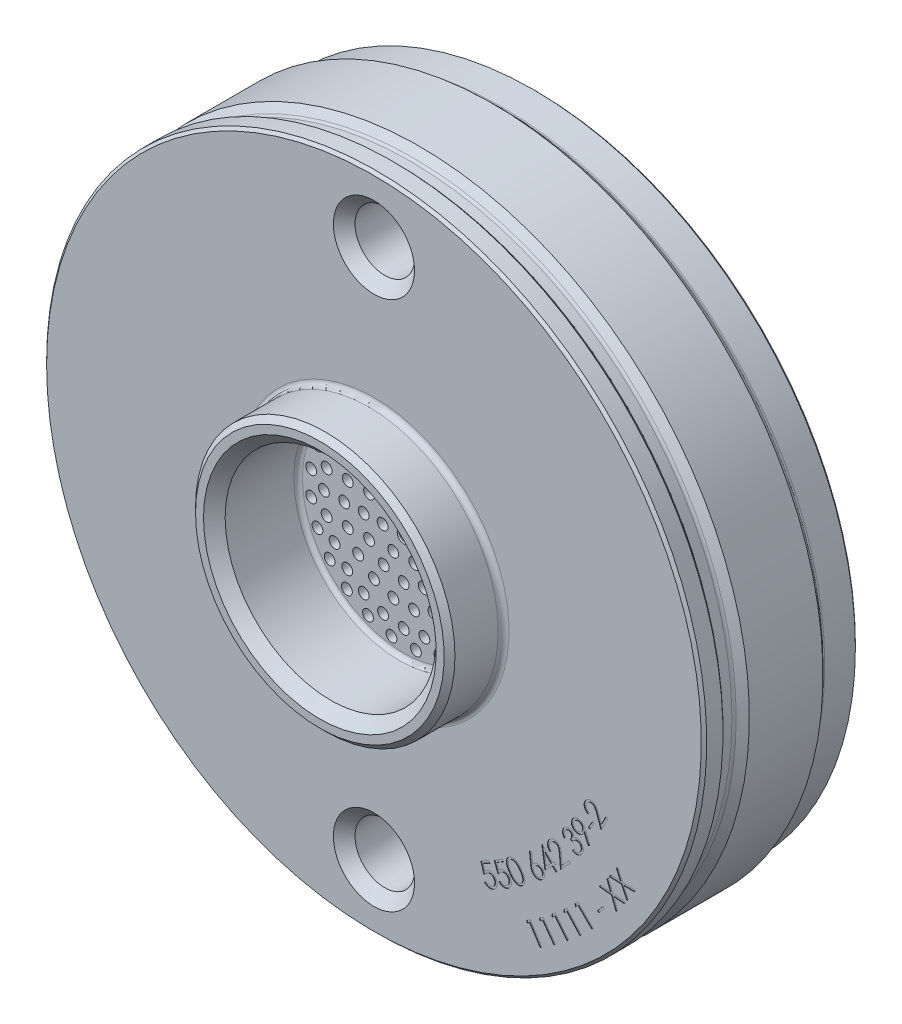
from build123d import *

# Parameters (mm, degrees)
F_11_0_11_DIAMETER_HOLE1_D           = 11
F_11_0_11_DIAMETER_HOLE1_DEPTH       = 12
F_11_0_11_DIAMETER_HOLE1_CSINK_D     = 15
F_11_0_11_DIAMETER_HOLE1_CSINK_ANGLE = 90
F_11_0_11_DIAMETER_HOLE1_TIP         = 3.304733405
CUT_EXTRUDE1_DEPTH                   = 0.1
F_2_0_2_DIAMETER_HOLE1_D             = 2
FILLET1_R                            = 0.8
CHAMFER1_SIZE                        = 0.2


with BuildPart() as part:
    # Sketch1 → Revolve1 (revolve)
    with BuildSketch(Plane(origin=(0, 0, 0), x_dir=(0, 0, -1), z_dir=(1, 0, 0)), mode=Mode.PRIVATE) as revolve1_sk:
        with BuildLine():
            Line((0, 48.5), (0, 59))
            Line((0, 59), (-0.5, 59.5))
            Line((-0.5, 59.5), (-6.16862915, 59.5))
            ThreePointArc((-6.16862915, 59.5), (-6.474775896, 59.560896374), (-6.734314575, 59.734314575))
            Line((-6.734314575, 59.734314575), (-7.95, 60.95))
            Line((-7.95, 60.95), (-21.55, 60.95))
            Line((-21.55, 60.95), (-22.765685425, 59.734314575))
            ThreePointArc((-22.765685425, 59.734314575), (-23.025224104, 59.560896374), (-23.33137085, 59.5))
            Line((-23.33137085, 59.5), (-25.18, 59.5))
            ThreePointArc((-25.18, 59.5), (-25.745685425, 59.734314575), (-25.98, 60.3))
            Line((-25.98, 60.3), (-25.98, 60.5))
            Line((-25.98, 60.5), (-26.48, 61))
            Line((-26.48, 61), (-29.48, 61))
            Line((-29.48, 61), (-29.98, 60.5))
            Line((-29.98, 60.5), (-29.98, 24.975))
            ThreePointArc((-29.98, 24.975), (-30.272893219, 24.267893219), (-30.98, 23.975))
            Line((-30.98, 23.975), (-38.98, 23.975))
            Line((-38.98, 23.975), (-39.98, 22.975))
            Line((-39.98, 22.975), (-39.98, 21.5))
            Line((-39.98, 21.5), (-37.98, 19.5))
            Line((-37.98, 19.5), (-24.48, 19.5))
            Line((-24.48, 19.5), (-24.48, 0))
            Line((-24.48, 0), (-18.95, 0))
            Line((-18.95, 0), (-18.95, 24.243093767))
            ThreePointArc((-18.95, 24.243093767), (-14.286781708, 37.786948462), (-2.274, 45.589171252))
            ThreePointArc((-2.274, 45.589171252), (-0.635893403, 46.653110723), (0, 48.5))
        make_face()
    revolve(revolve1_sk.sketch.rotate(Axis((0, 0, 0), (0, 0, 1)), 90), axis=Axis((0, 0, 0), (0, 0, 1)))

    # Ø11.0 (11) Diameter Hole1
    with Locations(Plane.XY.offset(29.98)):
        with Locations((0, -49), (0, 49)):
            CounterSinkHole(F_11_0_11_DIAMETER_HOLE1_D / 2, F_11_0_11_DIAMETER_HOLE1_CSINK_D / 2, depth=F_11_0_11_DIAMETER_HOLE1_DEPTH, counter_sink_angle=F_11_0_11_DIAMETER_HOLE1_CSINK_ANGLE)
            with Locations((0, 0, -(F_11_0_11_DIAMETER_HOLE1_DEPTH + F_11_0_11_DIAMETER_HOLE1_TIP / 2))):  # 118° drill point
                Cone(0, F_11_0_11_DIAMETER_HOLE1_D / 2, F_11_0_11_DIAMETER_HOLE1_TIP, mode=Mode.SUBTRACT)

    # Sketch18 → Cut-Extrude1 (cut)
    # profile 1 of 18: a face of its own
    with BuildSketch(Plane.XY.offset(29.98)):
        with BuildLine():
            Line((21.27644483, -38.521881996), (21.451124318, -38.858420458))
            Line((21.451124318, -38.858420458), (20.191508933, -39.51146533))
            Line((20.191508933, -39.51146533), (20.515226882, -40.566753791))
            add(Edge.make_bspline(
                [(20.515226882, -40.566753791), (20.547408769, -40.536904813), (20.60957525, -40.479244868), (20.706337394, -40.403190183), (20.800611648, -40.337256226), (20.865342477, -40.301289595), (20.896637138, -40.283901227)],
                knots=[0, 0, 0, 0, 1.105428389, 2.135381016, 3.098534353, 4, 4, 4, 4], degree=3))
            add(Edge.make_bspline(
                [(20.896637138, -40.283901227), (20.936640487, -40.264462137), (21.014961783, -40.226402955), (21.136279584, -40.182776443), (21.257414168, -40.152650923), (21.378572955, -40.132936329), (21.49985412, -40.129879758), (21.620951617, -40.137500513), (21.741774496, -40.158711559), (21.861466791, -40.192297775), (21.977734288, -40.237589196), (22.088207122, -40.294155458), (22.192274331, -40.360669408), (22.28891701, -40.439227237), (22.378793214, -40.52837429), (22.461458092, -40.628343041), (22.537537332, -40.7387575), (22.58109865, -40.818470932), (22.603367907, -40.85922174)],
                knots=[0, 0, 0, 0, 1.056811306, 2.069097534, 3.057789082, 4.02136795, 4.980690457, 5.935252029, 6.90190139, 7.890980264, 8.886175095, 9.86305164, 10.837055529, 11.816816882, 12.818070179, 13.841624952, 14.896603437, 16, 16, 16, 16], degree=3))
            add(Edge.make_bspline(
                [(22.603367907, -40.85922174), (22.63111572, -40.917348636), (22.685723876, -41.031743329), (22.739792203, -41.212923179), (22.772053908, -41.396614405), (22.7768758, -41.551642269), (22.769394881, -41.674646424), (22.758356095, -41.764879369), (22.741411054, -41.852667618), (22.719006455, -41.938180911), (22.690240884, -42.021184871), (22.655314996, -42.101861802), (22.615611645, -42.180278894), (22.569507701, -42.255868035), (22.518550129, -42.328545812), (22.462015018, -42.397855478), (22.400464253, -42.463787461), (22.332427028, -42.525211429), (22.260768424, -42.584777342), (22.183180819, -42.640105106), (22.10098306, -42.692392583), (22.04295035, -42.723373601), (22.013624318, -42.739029432)],
                knots=[0, 0, 0, 0, 1.748045973, 3.440183427, 5.119068867, 6.803952498, 7.640180652, 8.466618387, 9.272301908, 10.068050927, 10.866839438, 11.656907904, 12.45543257, 13.253330256, 14.060809883, 14.86564294, 15.682076094, 16.509151021, 17.354838291, 18.212924379, 19.096925907, 20, 20, 20, 20], degree=3))
            add(Edge.make_bspline(
                [(22.013624318, -42.739029432), (21.978123313, -42.756514679), (21.908106496, -42.790999937), (21.799772028, -42.83056192), (21.691614353, -42.860849113), (21.583452352, -42.880100596), (21.475081608, -42.8887513), (21.366653578, -42.888476495), (21.258007473, -42.875981537), (21.150209911, -42.85363974), (21.045224493, -42.821641836), (20.943838283, -42.781535865), (20.848033186, -42.731699086), (20.756715826, -42.673710571), (20.670714703, -42.606793402), (20.589571816, -42.531343866), (20.513778481, -42.446544048), (20.468016017, -42.38496727), (20.444714061, -42.353612766)],
                knots=[0, 0, 0, 0, 1.070326981, 2.110951231, 3.115813232, 4.106958124, 5.078831873, 6.054702745, 7.036552097, 8.033164546, 9.030170131, 10.003333336, 10.979685974, 11.948220681, 12.927085357, 13.924431534, 14.943133697, 16, 16, 16, 16], degree=3))
            Line((20.444714061, -42.353612766), (20.80769483, -42.165311483))
            add(Edge.make_bspline(
                [(20.80769483, -42.165311483), (20.832013106, -42.194098476), (20.878898976, -42.249600075), (20.955287693, -42.32236969), (21.033997519, -42.381535904), (21.115780351, -42.427295471), (21.200818344, -42.461566534), (21.290982485, -42.483668318), (21.385522111, -42.496509607), (21.483888555, -42.498896834), (21.583043687, -42.490086467), (21.680499284, -42.470667931), (21.775298934, -42.441533945), (21.834721995, -42.412883319), (21.864585856, -42.39848456)],
                knots=[0, 0, 0, 0, 1.148091184, 2.213530881, 3.208448489, 4.141584939, 5.062314057, 5.99434879, 6.963857466, 7.965580902, 8.98722283, 9.991556689, 10.990629709, 12, 12, 12, 12], degree=3))
            add(Edge.make_bspline(
                [(21.864585856, -42.39848456), (21.892719147, -42.382759841), (21.948249393, -42.351721968), (22.024543891, -42.295769967), (22.09397455, -42.234183673), (22.155356544, -42.165029548), (22.209987659, -42.089847384), (22.256713706, -42.007588461), (22.295007412, -41.918399403), (22.326946733, -41.824201904), (22.349910655, -41.726267562), (22.364019507, -41.627301002), (22.36685406, -41.527950087), (22.36083474, -41.428576698), (22.343371265, -41.329122801), (22.316950467, -41.229901774), (22.280801812, -41.130223655), (22.249283229, -41.065948089), (22.2331756, -41.033099945)],
                knots=[0, 0, 0, 0, 0.981645936, 1.9375991, 2.877432958, 3.805770378, 4.750353123, 5.705682002, 6.682827047, 7.704964642, 8.733856986, 9.744811227, 10.746775224, 11.758450475, 12.774375794, 13.819092033, 14.885443033, 16, 16, 16, 16], degree=3))
            add(Edge.make_bspline(
                [(22.2331756, -41.033099945), (22.217396411, -41.004212502), (22.186514055, -40.947675228), (22.132400344, -40.86971477), (22.073575345, -40.79926025), (22.009749701, -40.736870155), (21.94067969, -40.682397384), (21.867022522, -40.636075041), (21.788507786, -40.597014786), (21.705656652, -40.566951627), (21.619733013, -40.545304243), (21.532235059, -40.532258043), (21.443551316, -40.529083011), (21.353863725, -40.535698368), (21.263092102, -40.551758506), (21.171394523, -40.578151825), (21.078024861, -40.612121336), (21.017373814, -40.642020164), (20.986380728, -40.657298663)],
                knots=[0, 0, 0, 0, 1.076667265, 2.107207309, 3.099980189, 4.076690109, 5.022799446, 5.973501378, 6.91957033, 7.88747805, 8.852143453, 9.815183605, 10.777390248, 11.750219731, 12.753367975, 13.788421301, 14.869868663, 16, 16, 16, 16], degree=3))
            add(Edge.make_bspline(
                [(20.986380728, -40.657298663), (20.959997215, -40.671907963), (20.90560683, -40.702025464), (20.82608036, -40.755141791), (20.745172731, -40.815714607), (20.663757215, -40.884954796), (20.580417233, -40.961739599), (20.496387742, -41.046932393), (20.41129546, -41.139875664), (20.356049448, -41.205954542), (20.327726882, -41.239830714)],
                knots=[0, 0, 0, 0, 0.817702769, 1.685718268, 2.591285642, 3.557827698, 4.583179527, 5.664073486, 6.802457763, 8, 8, 8, 8], degree=3))
            Line((20.327726882, -41.239830714), (19.74519483, -39.315952509))
            Line((19.74519483, -39.315952509), (21.27644483, -38.521881996))
        make_face()
    # profile 2 of 18: a face of its own
    with BuildSketch(Plane.XY.offset(29.98)):
        with BuildLine():
            Line((23.70916149, -37.06250728), (23.905475593, -37.388629075))
            Line((23.905475593, -37.388629075), (22.685123029, -38.121802152))
            Line((22.685123029, -38.121802152), (23.07614867, -39.157859845))
            add(Edge.make_bspline(
                [(23.07614867, -39.157859845), (23.106515441, -39.126254802), (23.165183953, -39.065193953), (23.256159744, -38.982202366), (23.346132797, -38.910089091), (23.408852427, -38.870216667), (23.439129439, -38.850968819)],
                knots=[0, 0, 0, 0, 1.102829987, 2.130664318, 3.097604677, 4, 4, 4, 4], degree=3))
            add(Edge.make_bspline(
                [(23.439129439, -38.850968819), (23.478025642, -38.828904072), (23.554183934, -38.785701564), (23.672880484, -38.733742843), (23.792657539, -38.696561849), (23.91291503, -38.669762058), (24.034203362, -38.658519122), (24.156121146, -38.657824948), (24.278552568, -38.672074832), (24.400655045, -38.698393384), (24.519971072, -38.736749868), (24.634776731, -38.785449323), (24.742595107, -38.846843763), (24.843799408, -38.919695243), (24.94010214, -39.00232645), (25.028539674, -39.097609207), (25.112313806, -39.202886477), (25.160497814, -39.280204298), (25.185123029, -39.319718819)],
                knots=[0, 0, 0, 0, 1.058528882, 2.072586693, 3.060770653, 4.024670191, 4.984431329, 5.939491772, 6.906871252, 7.896834851, 8.892961989, 9.870461465, 10.84482513, 11.824184935, 12.819629119, 13.844283023, 14.898286032, 16, 16, 16, 16], degree=3))
            add(Edge.make_bspline(
                [(25.185123029, -39.319718819), (25.201540135, -39.347819767), (25.233992001, -39.403367206), (25.275501773, -39.489805664), (25.311979176, -39.57707183), (25.341330794, -39.666160987), (25.365442544, -39.756039226), (25.384250151, -39.846938183), (25.39600687, -39.939373806), (25.402310783, -40.03247947), (25.403484057, -40.125097505), (25.397533056, -40.216075668), (25.386656533, -40.305305985), (25.368820034, -40.392521425), (25.345611902, -40.477670441), (25.316634965, -40.560753654), (25.281507368, -40.641770281), (25.239399674, -40.720009327), (25.193239254, -40.796437835), (25.140889754, -40.869462297), (25.08309107, -40.939378805), (25.019583418, -41.005696152), (24.951358162, -41.069445588), (24.877072826, -41.1293625), (24.798238265, -41.187545698), (24.741751576, -41.222103502), (24.713167901, -41.239590614)],
                knots=[0, 0, 0, 0, 1.05692593, 2.089236547, 3.112499505, 4.127784259, 5.133905672, 6.134549002, 7.140894905, 8.158513096, 9.165120839, 10.147538755, 11.118353283, 12.08325527, 13.036854021, 13.983637869, 14.939602483, 15.902277905, 16.868115858, 17.838503713, 18.818427546, 19.812729982, 20.819674277, 21.84964819, 22.911868288, 24, 24, 24, 24], degree=3))
            add(Edge.make_bspline(
                [(24.713167901, -41.239590614), (24.678820016, -41.259555516), (24.611147338, -41.298890645), (24.504725178, -41.344374783), (24.398841206, -41.38241173), (24.291494475, -41.407613633), (24.183801877, -41.424017138), (24.075064086, -41.429918991), (23.965670436, -41.423618212), (23.856142874, -41.408895038), (23.748706668, -41.383102195), (23.644852704, -41.348730227), (23.545715991, -41.305047768), (23.450571129, -41.252835127), (23.359987437, -41.190971413), (23.274033652, -41.119803819), (23.191738133, -41.040691475), (23.142143293, -40.981780164), (23.117014055, -40.951930357)],
                knots=[0, 0, 0, 0, 1.070212441, 2.108547409, 3.115231964, 4.100383038, 5.076091677, 6.049618532, 7.030337432, 8.026404567, 9.025564965, 10.004828497, 10.972236263, 11.942427787, 12.927183942, 13.924889881, 14.948561242, 16, 16, 16, 16], degree=3))
            Line((23.117014055, -40.951930357), (23.468776875, -40.740391896))
            add(Edge.make_bspline(
                [(23.468776875, -40.740391896), (23.494556256, -40.76807422), (23.544305799, -40.821496098), (23.627018421, -40.8873927), (23.70898938, -40.942892079), (23.794318174, -40.983082597), (23.882088221, -41.011794318), (23.973764058, -41.028092535), (24.069105872, -41.035734698), (24.16742284, -41.031121406), (24.266172362, -41.017321019), (24.362336364, -40.991429687), (24.454978014, -40.955360344), (24.512648683, -40.923236962), (24.541693542, -40.907058562)],
                knots=[0, 0, 0, 0, 1.147819284, 2.215083569, 3.20552295, 4.149378301, 5.070774502, 6.003573808, 6.972124367, 7.971204786, 8.988124418, 9.996065887, 10.990752398, 12, 12, 12, 12], degree=3))
            add(Edge.make_bspline(
                [(24.541693542, -40.907058562), (24.569077311, -40.889741626), (24.6231041, -40.855576187), (24.696270854, -40.794811345), (24.761443144, -40.728128532), (24.818820561, -40.655271642), (24.868801158, -40.576487631), (24.910572108, -40.490996881), (24.944089378, -40.399366613), (24.969558992, -40.302800288), (24.986298831, -40.203564221), (24.993584261, -40.103494138), (24.991387634, -40.003884363), (24.978481056, -39.904766342), (24.95475501, -39.806419523), (24.921724219, -39.70859896), (24.879473485, -39.610887615), (24.843605127, -39.548560169), (24.825347388, -39.516834204)],
                knots=[0, 0, 0, 0, 0.983024875, 1.939458249, 2.880079426, 3.809832916, 4.750384155, 5.707986049, 6.69335027, 7.7084736, 8.73650763, 9.744869032, 10.750879176, 11.75688932, 12.773954853, 13.817831855, 14.889231074, 16, 16, 16, 16], degree=3))
            add(Edge.make_bspline(
                [(24.825347388, -39.516834204), (24.807646139, -39.48900546), (24.772988488, -39.434518971), (24.71407876, -39.359588281), (24.65093506, -39.292843361), (24.582759381, -39.234628532), (24.510863945, -39.183964181), (24.434115438, -39.141708544), (24.352544075, -39.109291624), (24.267970766, -39.083473314), (24.180743644, -39.066249752), (24.092263715, -39.060388833), (24.003378649, -39.06246582), (23.913971633, -39.074817084), (23.8239948, -39.09643245), (23.733976815, -39.128483544), (23.642572262, -39.168142063), (23.583847925, -39.202121549), (23.553712773, -39.219558562)],
                knots=[0, 0, 0, 0, 1.075733153, 2.106200774, 3.104921805, 4.069200433, 5.026719599, 5.970655112, 6.920727303, 7.885793418, 8.853296673, 9.814576963, 10.773681559, 11.749939262, 12.754084145, 13.787753641, 14.864757179, 16, 16, 16, 16], degree=3))
            add(Edge.make_bspline(
                [(23.553712773, -39.219558562), (23.528068246, -39.235727714), (23.475477117, -39.268886992), (23.399450988, -39.327770543), (23.321705081, -39.392736241), (23.24456154, -39.467591572), (23.166495644, -39.549642919), (23.087562523, -39.639940189), (23.008385449, -39.738475168), (22.956789907, -39.808054774), (22.930315337, -39.84375728)],
                knots=[0, 0, 0, 0, 0.819138095, 1.679867183, 2.597021237, 3.557141982, 4.583739267, 5.658351996, 6.798459653, 8, 8, 8, 8], degree=3))
            Line((22.930315337, -39.84375728), (22.225187132, -37.954334204))
            Line((22.225187132, -37.954334204), (23.70916149, -37.06250728))
        make_face()
    # profile 3 of 18: a face of its own
    with BuildSketch(Plane.XY.offset(29.98)):
        with BuildLine():
            add(Edge.make_bspline(
                [(25.067604612, -38.574110643), (25.031440738, -38.521204796), (24.961274924, -38.418555899), (24.865289902, -38.265118053), (24.779118256, -38.118775197), (24.704260608, -37.978147485), (24.640139809, -37.843650749), (24.585865244, -37.7155708), (24.543320249, -37.593452327), (24.510380391, -37.477115749), (24.488664247, -37.364888184), (24.471706886, -37.256463308), (24.464000908, -37.150638467), (24.462959115, -37.047837525), (24.469383251, -36.947937166), (24.482863289, -36.85093037), (24.503902875, -36.756659551), (24.531597988, -36.665384271), (24.567312799, -36.578128013), (24.607876447, -36.494624973), (24.654816898, -36.415797817), (24.706660453, -36.3408087), (24.765743842, -36.271132499), (24.829742067, -36.205247361), (24.899785087, -36.143982988), (24.950069346, -36.107136835), (24.975457176, -36.08853372)],
                knots=[0, 0, 0, 0, 1.648880835, 3.199188929, 4.656147039, 6.018196139, 7.297073251, 8.489259402, 9.595625968, 10.622797314, 11.597320629, 12.535289308, 13.445112111, 14.324870503, 15.178882248, 16.018671089, 16.842416504, 17.662022758, 18.469903163, 19.266003679, 20.04867009, 20.82849472, 21.609045895, 22.39640582, 23.190367395, 24, 24, 24, 24], degree=3))
            add(Edge.make_bspline(
                [(24.975457176, -36.08853372), (25.002209226, -36.071074774), (25.0551918, -36.03649724), (25.13805137, -35.991385794), (25.223051407, -35.953758097), (25.310073683, -35.923027152), (25.399327536, -35.899691009), (25.491038564, -35.883908608), (25.584722891, -35.874158669), (25.680393103, -35.87157122), (25.777063847, -35.877563144), (25.874976829, -35.890080499), (25.973214614, -35.912049828), (26.072068501, -35.941701738), (26.171148929, -35.980046754), (26.271394052, -36.02524741), (26.371304199, -36.080605547), (26.473046956, -36.142146876), (26.575264923, -36.213850943), (26.677802565, -36.296815017), (26.781225104, -36.390563476), (26.884518618, -36.496383912), (26.989325732, -36.612149811), (27.094529712, -36.739701612), (27.200917707, -36.877672437), (27.269626716, -36.975285353), (27.304784099, -37.025232438)],
                knots=[0, 0, 0, 0, 0.816193038, 1.616474579, 2.407974418, 3.189491804, 3.972617313, 4.762673534, 5.56551282, 6.378072658, 7.205407521, 8.03855107, 8.898147562, 9.774918361, 10.673732565, 11.611515667, 12.582857779, 13.59082979, 14.649420231, 15.770911779, 16.959705856, 18.214699789, 19.548597452, 20.949604708, 22.439157853, 24, 24, 24, 24], degree=3))
            add(Edge.make_bspline(
                [(27.304784099, -37.025232438), (27.339049821, -37.075754036), (27.405642174, -37.173938223), (27.49728326, -37.321222737), (27.579190868, -37.463473866), (27.650803639, -37.601721695), (27.712482009, -37.735064242), (27.76448583, -37.863767113), (27.805294853, -37.988075454), (27.836926904, -38.107959012), (27.859266056, -38.223961161), (27.874638813, -38.336301579), (27.883082701, -38.445488196), (27.882868953, -38.551797769), (27.875933348, -38.65491746), (27.861269114, -38.755051437), (27.840150656, -38.852001759), (27.810075762, -38.945020411), (27.773913098, -39.034069732), (27.732399923, -39.119103223), (27.684991162, -39.199485947), (27.631775504, -39.27539277), (27.572485352, -39.346623723), (27.50733167, -39.413267175), (27.436473172, -39.475636487), (27.385226467, -39.512813471), (27.359271278, -39.531642695)],
                knots=[0, 0, 0, 0, 1.562410196, 3.036403893, 4.438953896, 5.762941119, 7.020166583, 8.198282941, 9.313840987, 10.366808227, 11.369714488, 12.335610463, 13.267896066, 14.170325268, 15.054388479, 15.911010107, 16.758581212, 17.590989815, 18.409840322, 19.2170207, 20.010800903, 20.796026648, 21.587329968, 22.380196983, 23.179609817, 24, 24, 24, 24], degree=3))
            add(Edge.make_bspline(
                [(27.359271278, -39.531642695), (27.333158941, -39.549291651), (27.281482102, -39.584219289), (27.198751837, -39.626523247), (27.115761738, -39.665389507), (27.029481699, -39.69423095), (26.942206893, -39.718374806), (26.852412052, -39.732687044), (26.760987827, -39.743235295), (26.667418751, -39.744188121), (26.572791487, -39.739041998), (26.477814591, -39.724764991), (26.382154571, -39.704544087), (26.286674477, -39.673953931), (26.190318294, -39.637456813), (26.093862006, -39.592046964), (25.996984095, -39.539118881), (25.899090627, -39.477986565), (25.801014363, -39.405690889), (25.700322602, -39.323203407), (25.59925074, -39.227318292), (25.495277658, -39.120575658), (25.390982442, -39.000915397), (25.283967628, -38.869797926), (25.175355692, -38.726695154), (25.104161428, -38.625878142), (25.067604612, -38.574110643)],
                knots=[0, 0, 0, 0, 0.81152306, 1.606020402, 2.391670559, 3.171052736, 3.947510848, 4.722747345, 5.511858203, 6.317402894, 7.13114196, 7.951839656, 8.790359576, 9.64823863, 10.532932001, 11.444534705, 12.393352557, 13.376992827, 14.416566744, 15.531560906, 16.729652367, 18.005142895, 19.370917127, 20.819142754, 22.366694092, 24, 24, 24, 24], degree=3))
        make_face()
        with BuildLine():
            add(Edge.make_bspline(
                [(25.380905894, -38.36577731), (25.412125665, -38.410596896), (25.47256786, -38.497368644), (25.565140135, -38.619794314), (25.653863473, -38.732434135), (25.740400492, -38.834318964), (25.824146419, -38.925669017), (25.905294759, -39.006014177), (25.982948699, -39.076362187), (26.081639349, -39.154033382), (26.204006079, -39.23314069), (26.353105423, -39.304198683), (26.502784405, -39.34954462), (26.650893286, -39.368687379), (26.793862463, -39.364659847), (26.928386334, -39.340608867), (27.054418445, -39.297446205), (27.128449532, -39.251076484), (27.165361022, -39.227956797)],
                knots=[0, 0, 0, 0, 1.18360187, 2.291480407, 3.325641566, 4.290620188, 5.187729821, 6.010420189, 6.76463185, 7.457100541, 8.730339266, 9.913672188, 11.025279315, 12.105085573, 13.135806874, 14.112227409, 15.058767036, 16, 16, 16, 16], degree=3))
            add(Edge.make_bspline(
                [(27.165361022, -39.227956797), (27.200119041, -39.201378035), (27.269582952, -39.14826037), (27.354408456, -39.046463979), (27.424677444, -38.931090475), (27.467393197, -38.823535483), (27.494463812, -38.731741949), (27.507814602, -38.658956451), (27.514931347, -38.583622709), (27.516390169, -38.505962755), (27.512522429, -38.425594408), (27.501782819, -38.342616992), (27.485065639, -38.257252565), (27.469659859, -38.200095441), (27.461835381, -38.171065772)],
                knots=[0, 0, 0, 0, 1.336851993, 2.671699108, 4.03011382, 5.461489002, 6.202186282, 6.95968723, 7.724226666, 8.518110209, 9.337395127, 10.186892147, 11.079136272, 12, 12, 12, 12], degree=3))
            add(Edge.make_bspline(
                [(27.461835381, -38.171065772), (27.450970543, -38.134361257), (27.428905283, -38.05981853), (27.388586834, -37.948249989), (27.341034493, -37.835362398), (27.287187236, -37.720343329), (27.226295392, -37.603488921), (27.15805526, -37.484848234), (27.082478914, -37.36461294), (27.028566857, -37.284699183), (27.001098201, -37.243982438)],
                knots=[0, 0, 0, 0, 0.883199446, 1.793678394, 2.735757982, 3.709095344, 4.723597835, 5.775548499, 6.866622892, 8, 8, 8, 8], degree=3))
            add(Edge.make_bspline(
                [(27.001098201, -37.243982438), (26.973002189, -37.204032666), (26.917925053, -37.125718381), (26.833544719, -37.013508173), (26.747842486, -36.910605416), (26.665418542, -36.813337052), (26.580483341, -36.726834284), (26.498667593, -36.645784324), (26.415447528, -36.574447716), (26.333447309, -36.51037919), (26.251827857, -36.45414437), (26.172159466, -36.403905661), (26.092236295, -36.362378076), (26.014010474, -36.326909794), (25.936688353, -36.298422228), (25.860199937, -36.27779467), (25.785046355, -36.262651589), (25.687678854, -36.254903664), (25.570882917, -36.258086117), (25.437421287, -36.280865106), (25.313169747, -36.324715607), (25.239707136, -36.370271258), (25.203021278, -36.3930209)],
                knots=[0, 0, 0, 0, 1.324721128, 2.59687554, 3.806453397, 4.95685349, 6.053294923, 7.093309125, 8.079471706, 9.024294149, 9.914547597, 10.766943994, 11.577070158, 12.355310455, 13.095566322, 13.809107535, 14.502467157, 15.171479925, 16.45427501, 17.660811757, 18.831853037, 20, 20, 20, 20], degree=3))
            add(Edge.make_bspline(
                [(25.203021278, -36.3930209), (25.168297512, -36.419623915), (25.098602389, -36.473019633), (25.012803807, -36.575186392), (24.943172684, -36.692600584), (24.899311189, -36.801052966), (24.872289043, -36.894057162), (24.859161104, -36.967685804), (24.851076521, -37.043457287), (24.848508387, -37.121423943), (24.852916801, -37.201739155), (24.86253421, -37.284436374), (24.878031133, -37.369467464), (24.898660901, -37.457779977), (24.928244013, -37.550025202), (24.966153309, -37.647856606), (25.012944545, -37.752022228), (25.068306518, -37.862826773), (25.133575534, -37.979576543), (25.207453386, -38.102939743), (25.289911261, -38.23304961), (25.349906134, -38.320560062), (25.380905894, -38.36577731)],
                knots=[0, 0, 0, 0, 1.182397344, 2.373225514, 3.587098347, 4.869233932, 5.531312716, 6.208410436, 6.892549624, 7.59489743, 8.319525375, 9.070002934, 9.849376579, 10.660367206, 11.525572944, 12.471770961, 13.502004006, 14.618628064, 15.826986852, 17.125259499, 18.514601967, 20, 20, 20, 20], degree=3))
        make_face(mode=Mode.SUBTRACT)
    # profile 4 of 18: a face of its own
    with BuildSketch(Plane.XY.offset(29.98)):
        with BuildLine():
            Line((28.731695991, -33.225282585), (29.117913939, -33.176404379))
            Line((29.117913939, -33.176404379), (29.346279324, -35.102686431))
            add(Edge.make_bspline(
                [(29.346279324, -35.102686431), (29.36613607, -35.071401349), (29.404693055, -35.010653307), (29.468526787, -34.926642742), (29.53557472, -34.851551873), (29.584390969, -34.80767068), (29.608298555, -34.78618002)],
                knots=[0, 0, 0, 0, 1.07736379, 2.091979248, 3.06555359, 4, 4, 4, 4], degree=3))
            add(Edge.make_bspline(
                [(29.608298555, -34.78618002), (29.638256507, -34.761999923), (29.697364914, -34.714291488), (29.793228916, -34.655425135), (29.892073691, -34.606517765), (29.994307337, -34.568614927), (30.100691025, -34.543449368), (30.209740983, -34.526600822), (30.322592172, -34.523372769), (30.437308567, -34.529782803), (30.551808104, -34.545911594), (30.662688947, -34.574513221), (30.769162623, -34.612012301), (30.871002362, -34.660525238), (30.967756926, -34.719877638), (31.059758459, -34.789678346), (31.147712496, -34.868864996), (31.200740506, -34.928798478), (31.22768958, -34.959256944)],
                knots=[0, 0, 0, 0, 1.017453821, 2.007482787, 2.968006987, 3.931359126, 4.884082859, 5.855252888, 6.844979309, 7.863903794, 8.892020816, 9.897855235, 10.887783363, 11.873745447, 12.875801323, 13.884683019, 14.924986379, 16, 16, 16, 16], degree=3))
            add(Edge.make_bspline(
                [(31.22768958, -34.959256944), (31.262284668, -35.003018026), (31.330080479, -35.088776389), (31.410091569, -35.230574703), (31.469848373, -35.378429144), (31.508310694, -35.532180377), (31.526148115, -35.688734267), (31.522328571, -35.846578097), (31.495096984, -36.004182017), (31.44703277, -36.159379848), (31.380076486, -36.308943087), (31.294806731, -36.44841093), (31.191427898, -36.575875725), (31.110627551, -36.649601816), (31.069837016, -36.686821046)],
                knots=[0, 0, 0, 0, 1.036897132, 2.032001818, 3.017814009, 3.996747231, 4.972191115, 5.941804272, 6.924880705, 7.939021592, 8.958023578, 9.966545236, 10.97344863, 12, 12, 12, 12], degree=3))
            add(Edge.make_bspline(
                [(31.069837016, -36.686821046), (31.027645666, -36.720034792), (30.944432825, -36.78554135), (30.806175296, -36.863030386), (30.659990827, -36.920877788), (30.507418046, -36.96028641), (30.351344956, -36.978862755), (30.19467314, -36.975617135), (30.039050791, -36.950566539), (29.886650706, -36.903610423), (29.740281334, -36.839054387), (29.606043948, -36.753717279), (29.480186369, -36.656081286), (29.409260759, -36.576886036), (29.373522914, -36.536981303)],
                knots=[0, 0, 0, 0, 1.017991448, 2.007756561, 2.995298984, 3.994960056, 4.990395737, 5.969049444, 6.960034262, 7.971999043, 8.98862623, 9.98600936, 10.985194682, 12, 12, 12, 12], degree=3))
            add(Edge.make_bspline(
                [(29.373522914, -36.536981303), (29.348023899, -36.504870233), (29.296095815, -36.43947687), (29.229335441, -36.330622493), (29.169755776, -36.21169839), (29.126358327, -36.105076181), (29.094229681, -36.013321725), (29.073056043, -35.937366134), (29.05222584, -35.856210602), (29.032831605, -35.769118842), (29.015712267, -35.676265796), (28.998336509, -35.577856813), (28.984488133, -35.473497269), (28.975755875, -35.40210556), (28.971279324, -35.365506944)],
                knots=[0, 0, 0, 0, 1.173382862, 2.389563872, 3.648389318, 4.979326365, 5.683236405, 6.431308717, 7.23644792, 8.082684515, 8.985777524, 9.94021042, 10.944058753, 12, 12, 12, 12], degree=3))
            Line((28.971279324, -35.365506944), (28.731695991, -33.225282585))
        make_face()
        with BuildLine():
            add(Edge.make_bspline(
                [(29.759740862, -35.111500533), (29.738880099, -35.130418215), (29.697706383, -35.167756791), (29.641655559, -35.228659291), (29.594981748, -35.294705751), (29.553828401, -35.363437398), (29.521443447, -35.436507563), (29.49515256, -35.513051718), (29.47816809, -35.593847619), (29.46670484, -35.676841346), (29.46348744, -35.760860199), (29.468478996, -35.843162762), (29.480057348, -35.923626155), (29.501388836, -36.000987486), (29.529137554, -36.076588003), (29.567039135, -36.148605854), (29.610348907, -36.21969565), (29.645704137, -36.263315544), (29.663587016, -36.285378738)],
                knots=[0, 0, 0, 0, 1.031419157, 2.035752835, 3.024137596, 3.988997682, 4.965543905, 5.946345039, 6.948149687, 7.984568571, 9.012641068, 10.022108632, 11.001786702, 11.984343099, 12.956566561, 13.94548387, 14.960813884, 16, 16, 16, 16], degree=3))
            add(Edge.make_bspline(
                [(29.663587016, -36.285378738), (29.682494111, -36.30625499), (29.719811794, -36.347459275), (29.780707037, -36.403140318), (29.846178186, -36.450675694), (29.915255122, -36.4907986), (29.987941639, -36.523917273), (30.064358766, -36.549931648), (30.144869789, -36.566871073), (30.227591229, -36.578495561), (30.311325893, -36.581518172), (30.39375762, -36.577012092), (30.473616222, -36.563758171), (30.551266249, -36.544195492), (30.625829266, -36.514683959), (30.698056079, -36.478686996), (30.768177792, -36.435076248), (30.811375223, -36.400175822), (30.833458811, -36.382333867)],
                knots=[0, 0, 0, 0, 1.034732679, 2.042292864, 3.025902142, 4.002334923, 4.973077632, 5.957029673, 6.962052704, 7.992072589, 9.023447857, 10.036158422, 11.020502046, 11.994217637, 12.973064834, 13.960730653, 14.95747541, 16, 16, 16, 16], degree=3))
            add(Edge.make_bspline(
                [(30.833458811, -36.382333867), (30.854335061, -36.363426772), (30.895539342, -36.326109089), (30.95122041, -36.265213845), (30.998755693, -36.199742697), (31.038878945, -36.130665759), (31.071996331, -36.057979251), (31.098015602, -35.981562091), (31.114936167, -35.901051195), (31.126633074, -35.818329265), (31.129384923, -35.734610686), (31.12586478, -35.652227876), (31.11370319, -35.572201039), (31.093610648, -35.494843418), (31.065341465, -35.419943018), (31.029262226, -35.347614102), (30.984622178, -35.278213466), (30.95027992, -35.234625437), (30.932817785, -35.212462072)],
                knots=[0, 0, 0, 0, 1.035138053, 2.043092968, 3.027087591, 4.003902906, 4.97502592, 5.959363441, 6.964780207, 7.99520362, 9.026982946, 10.039566676, 11.022777084, 11.996874144, 12.972603066, 13.960655819, 14.96304718, 16, 16, 16, 16], degree=3))
            add(Edge.make_bspline(
                [(30.932817785, -35.212462072), (30.913995925, -35.191229655), (30.8768413, -35.149316556), (30.814572326, -35.094007475), (30.749035996, -35.045626966), (30.679156437, -35.005425705), (30.606456784, -34.97150362), (30.529624604, -34.94555002), (30.448879525, -34.928464029), (30.365870118, -34.917023836), (30.281861149, -34.913819534), (30.19953541, -34.918737806), (30.119475998, -34.930540148), (30.042123233, -34.95072771), (29.96722153, -34.978971409), (29.894892969, -35.015057574), (29.825492237, -35.059695753), (29.781904221, -35.094038268), (29.759740862, -35.111500533)],
                knots=[0, 0, 0, 0, 1.038988932, 2.050979244, 3.045494615, 4.019177073, 5.000162312, 5.98134285, 6.983535027, 8.020354829, 9.048825016, 10.058683074, 11.038740113, 12.009713034, 12.982312582, 13.967196437, 14.966372911, 16, 16, 16, 16], degree=3))
        make_face(mode=Mode.SUBTRACT)
    # profile 5 of 18: a face of its own
    with BuildSketch(Plane.XY.offset(29.98)):
        Polygon((31.026212037, -31.051265674), (31.084705626, -30.995175931), (33.010987678, -32.997579777), (33.358744088, -32.662643879), (33.623167165, -32.937483623), (33.275410755, -33.27241952), (33.918840242, -33.940688751), (33.631179985, -34.217131059), (32.987750498, -33.548861828), (31.615154344, -34.870175931), align=None)
        Polygon((32.723327421, -33.274022085), (31.571083832, -32.076105418), (31.877974857, -34.088124649), align=None, mode=Mode.SUBTRACT)
    # profile 6 of 18: a face of its own
    with BuildSketch(Plane.XY.offset(29.98)):
        with BuildLine():
            Line((32.782364898, -31.182483675), (32.524352077, -31.465336239))
            add(Edge.make_bspline(
                [(32.524352077, -31.465336239), (32.490345539, -31.430913557), (32.423751973, -31.363505076), (32.33586989, -31.254246529), (32.260349041, -31.141432022), (32.197411319, -31.02438635), (32.146459241, -30.903804845), (32.108718375, -30.779160388), (32.083863692, -30.650526396), (32.071135537, -30.51933849), (32.070950712, -30.387816264), (32.083977513, -30.259042073), (32.108534994, -30.134045906), (32.146719001, -30.013393489), (32.196420522, -29.896367964), (32.259811992, -29.783699369), (32.334704001, -29.67433222), (32.393574948, -29.606873142), (32.423390539, -29.572708034)],
                knots=[0, 0, 0, 0, 1.099423663, 2.152954839, 3.181895659, 4.181613889, 5.169460763, 6.152912655, 7.136514486, 8.143068601, 9.144923456, 10.121264468, 11.08103902, 12.035478615, 12.993003399, 13.966091571, 14.969913246, 16, 16, 16, 16], degree=3))
            add(Edge.make_bspline(
                [(32.423390539, -29.572708034), (32.454321795, -29.540310354), (32.514982523, -29.476773756), (32.614215538, -29.393675723), (32.71620474, -29.321149), (32.823117639, -29.262669824), (32.933598743, -29.216715554), (33.047690059, -29.18267153), (33.165613387, -29.160901795), (33.286240783, -29.152677547), (33.406100131, -29.154976033), (33.52332499, -29.167796465), (33.63629891, -29.19096972), (33.745314568, -29.224374945), (33.849104366, -29.270343429), (33.949831076, -29.32437649), (34.045740452, -29.390591757), (34.104938214, -29.441797976), (34.134929, -29.467740085)],
                knots=[0, 0, 0, 0, 1.121956214, 2.200320588, 3.238556949, 4.254273401, 5.247681344, 6.232638839, 7.233239619, 8.24683576, 9.257952584, 10.23459304, 11.198321155, 12.144850816, 13.086347731, 14.039013333, 15.006524383, 16, 16, 16, 16], degree=3))
            add(Edge.make_bspline(
                [(34.134929, -29.467740085), (34.174774243, -29.506804754), (34.253772117, -29.584255047), (34.352253656, -29.717750899), (34.435284149, -29.861040247), (34.488128275, -29.991648561), (34.522720136, -30.105834583), (34.548514037, -30.203254476), (34.571213932, -30.312493414), (34.592884217, -30.432727138), (34.612519693, -30.56453937), (34.632102327, -30.707615355), (34.648618978, -30.862636873), (34.65807374, -30.969861134), (34.662973872, -31.025432393)],
                knots=[0, 0, 0, 0, 1.188533333, 2.356406923, 3.52515557, 4.713210936, 5.351116087, 6.069654131, 6.861857209, 7.730132082, 8.675224071, 9.704102313, 10.810102104, 12, 12, 12, 12], degree=3))
            Line((34.662973872, -31.025432393), (34.784768744, -32.48136188))
            Line((34.784768744, -32.48136188), (36.025954641, -31.121586239))
            Line((36.025954641, -31.121586239), (36.31040977, -31.381201623))
            Line((36.31040977, -31.381201623), (34.484287975, -33.382002905))
            Line((34.484287975, -33.382002905), (34.295185411, -31.1456247))
            add(Edge.make_bspline(
                [(34.295185411, -31.1456247), (34.290895361, -31.091381358), (34.282646904, -30.987087946), (34.266775857, -30.837352273), (34.252296007, -30.700171113), (34.235273774, -30.575993835), (34.217857159, -30.4648236), (34.199798487, -30.366335338), (34.179582122, -30.280959218), (34.153830392, -30.184361089), (34.11321413, -30.076565887), (34.050407621, -29.958779245), (33.973397404, -29.851213422), (33.910733751, -29.790062256), (33.879320026, -29.759406752)],
                knots=[0, 0, 0, 0, 1.319911279, 2.537787007, 3.652573464, 4.666047536, 5.577887411, 6.382292382, 7.094254265, 7.70572053, 8.806847171, 9.879369736, 10.936913301, 12, 12, 12, 12], degree=3))
            add(Edge.make_bspline(
                [(33.879320026, -29.759406752), (33.858627397, -29.741248106), (33.81764141, -29.705281191), (33.749651224, -29.661142193), (33.680029165, -29.622472685), (33.606218313, -29.593899562), (33.529774124, -29.572221161), (33.450143669, -29.557279836), (33.367104381, -29.552429806), (33.282105566, -29.553669428), (33.197373612, -29.563357063), (33.114623541, -29.580041233), (33.035331722, -29.60518363), (32.958765745, -29.636925709), (32.886026089, -29.6777829), (32.816498938, -29.725714394), (32.749962515, -29.781564746), (32.709345827, -29.823658898), (32.688614898, -29.845143931)],
                knots=[0, 0, 0, 0, 0.994339893, 1.969493662, 2.924636697, 3.869911627, 4.823881747, 5.795825007, 6.793022675, 7.826742932, 8.86676203, 9.872669827, 10.874720976, 11.870373653, 12.864854284, 13.885677508, 14.920840879, 16, 16, 16, 16], degree=3))
            add(Edge.make_bspline(
                [(32.688614898, -29.845143931), (32.668127764, -29.868822937), (32.628042266, -29.915153712), (32.576433332, -29.989859058), (32.532804132, -30.066284765), (32.499261323, -30.146189711), (32.472022327, -30.227634919), (32.455862843, -30.312259006), (32.446567267, -30.398854696), (32.446904063, -30.487449937), (32.455337978, -30.576923277), (32.474172972, -30.66605769), (32.502505251, -30.754192565), (32.53947926, -30.842026916), (32.58626359, -30.928890375), (32.64312638, -31.014540458), (32.70745437, -31.100790305), (32.757029697, -31.154854475), (32.782364898, -31.182483675)],
                knots=[0, 0, 0, 0, 1.006465744, 1.969269201, 2.91552602, 3.831503621, 4.752503397, 5.672420705, 6.596500556, 7.550099584, 8.516919122, 9.4823636, 10.474054733, 11.490444544, 12.543602261, 13.642072812, 14.794994151, 16, 16, 16, 16], degree=3))
        make_face()
    # profile 7 of 18: a face of its own
    with BuildSketch(Plane.XY.offset(29.98)):
        with BuildLine():
            Line((35.435067131, -27.638496021), (35.192278669, -27.961412687))
            add(Edge.make_bspline(
                [(35.192278669, -27.961412687), (35.166070365, -27.929786822), (35.114838001, -27.867964132), (35.049067638, -27.76988807), (34.989144058, -27.673375952), (34.94166119, -27.574095369), (34.901387806, -27.474901632), (34.873296964, -27.373880186), (34.851372263, -27.27289466), (34.841639926, -27.171044012), (34.839794309, -27.070006554), (34.84697583, -26.970492783), (34.863043421, -26.873130697), (34.887883513, -26.778115334), (34.922165125, -26.685644832), (34.963496185, -26.594544335), (35.015321417, -26.506254904), (35.055113624, -26.44991664), (35.07529149, -26.421348585)],
                knots=[0, 0, 0, 0, 1.1718079, 2.290666659, 3.368228699, 4.411772172, 5.428447976, 6.420344262, 7.401365682, 8.374830831, 9.33573151, 10.28374792, 11.218920161, 12.149230121, 13.082784416, 14.031291359, 15.001705542, 16, 16, 16, 16], degree=3))
            add(Edge.make_bspline(
                [(35.07529149, -26.421348585), (35.107193344, -26.381758274), (35.170438013, -26.303271419), (35.281400085, -26.201440724), (35.402672012, -26.113953535), (35.533208011, -26.042380532), (35.669856568, -25.987694953), (35.809143954, -25.952178974), (35.949311436, -25.935461227), (36.088457619, -25.939956243), (36.223377121, -25.961842137), (36.351812488, -25.997671346), (36.470590653, -26.053071998), (36.541965182, -26.101454956), (36.577695336, -26.125675508)],
                knots=[0, 0, 0, 0, 1.076893072, 2.134915015, 3.181751288, 4.24125775, 5.283503052, 6.294503545, 7.28083629, 8.266713635, 9.236004437, 10.173449683, 11.085627259, 12, 12, 12, 12], degree=3))
            add(Edge.make_bspline(
                [(36.577695336, -26.125675508), (36.610064279, -26.151741555), (36.673879326, -26.203130504), (36.75377348, -26.295068873), (36.820966633, -26.39400393), (36.870645115, -26.503136115), (36.906066584, -26.620378898), (36.926634466, -26.746113674), (36.932462476, -26.880673348), (36.924147929, -26.972407567), (36.919842772, -27.019906277)],
                knots=[0, 0, 0, 0, 0.989373263, 1.950539457, 2.892173263, 3.832664505, 4.797874717, 5.805271869, 6.863600109, 8, 8, 8, 8], degree=3))
            add(Edge.make_bspline(
                [(36.919842772, -27.019906277), (36.963878422, -26.995208638), (37.050589719, -26.946576125), (37.1888645, -26.895090519), (37.329759116, -26.859592216), (37.425515833, -26.852158977), (37.473528669, -26.848431918)],
                knots=[0, 0, 0, 0, 1.033339284, 2.034764792, 3.014622469, 4, 4, 4, 4], degree=3))
            add(Edge.make_bspline(
                [(37.473528669, -26.848431918), (37.5069314, -26.847487691), (37.572777171, -26.845626366), (37.670283615, -26.854584807), (37.764982255, -26.869295413), (37.856759493, -26.892594924), (37.945232281, -26.924377312), (38.031503721, -26.962488613), (38.114116993, -27.010022726), (38.166122945, -27.046988096), (38.192278669, -27.065579354)],
                knots=[0, 0, 0, 0, 1.045670472, 2.061297868, 3.06109309, 4.045085854, 5.021368188, 6.002369653, 6.995317482, 8, 8, 8, 8], degree=3))
            add(Edge.make_bspline(
                [(38.192278669, -27.065579354), (38.235590849, -27.100716246), (38.321882061, -27.170719765), (38.431822055, -27.29735011), (38.526710895, -27.437747399), (38.602613754, -27.592414923), (38.659464597, -27.755371931), (38.694054825, -27.923242976), (38.703333263, -28.093787267), (38.689429759, -28.265362087), (38.653432928, -28.435711651), (38.594245386, -28.601798377), (38.512907755, -28.762905428), (38.44328156, -28.86257684), (38.407823541, -28.913335764)],
                knots=[0, 0, 0, 0, 0.967502181, 1.927562528, 2.900669604, 3.905218681, 4.912059321, 5.892311476, 6.873134745, 7.869427306, 8.875229894, 9.889519518, 10.925211189, 12, 12, 12, 12], degree=3))
            add(Edge.make_bspline(
                [(38.407823541, -28.913335764), (38.381884828, -28.946345902), (38.331187486, -29.010864379), (38.247887496, -29.098859783), (38.160385756, -29.177094684), (38.06808025, -29.245011858), (37.972167204, -29.304359409), (37.871657997, -29.353140878), (37.767193131, -29.392794005), (37.658688417, -29.421599574), (37.547067982, -29.439860247), (37.432764999, -29.448441506), (37.31608689, -29.44357459), (37.19664681, -29.429527271), (37.075151629, -29.402428141), (36.950926472, -29.36520287), (36.824292337, -29.317467184), (36.741140705, -29.277493639), (36.698688926, -29.257085764)],
                knots=[0, 0, 0, 0, 1.050796176, 2.053786274, 3.029651288, 3.986071122, 4.919772151, 5.850017505, 6.779180324, 7.713623611, 8.655908385, 9.607968795, 10.578317807, 11.575448562, 12.615720254, 13.69065211, 14.820998184, 16, 16, 16, 16], degree=3))
            Line((36.698688926, -29.257085764), (36.931060721, -28.94698961))
            add(Edge.make_bspline(
                [(36.931060721, -28.94698961), (36.961126041, -28.958792921), (37.019422699, -28.98167954), (37.106351319, -29.00982062), (37.189782271, -29.031786177), (37.269642785, -29.046705813), (37.345579602, -29.056955966), (37.417962054, -29.060179921), (37.486933283, -29.057323109), (37.531264436, -29.050481851), (37.552855593, -29.047149867)],
                knots=[0, 0, 0, 0, 1.214576304, 2.355063561, 3.434452079, 4.456995273, 5.408955916, 6.31396272, 7.178828135, 8, 8, 8, 8], degree=3))
            add(Edge.make_bspline(
                [(37.552855593, -29.047149867), (37.57943926, -29.040988348), (37.632292395, -29.028738134), (37.708950416, -29.001225739), (37.782130593, -28.965389762), (37.852809125, -28.92331372), (37.919641855, -28.872450517), (37.984908802, -28.816134345), (38.045817467, -28.750466261), (38.083363878, -28.70286522), (38.10253508, -28.678560123)],
                knots=[0, 0, 0, 0, 0.966604749, 1.921784886, 2.878652291, 3.851126368, 4.831859007, 5.851521617, 6.902986679, 8, 8, 8, 8], degree=3))
            add(Edge.make_bspline(
                [(38.10253508, -28.678560123), (38.123160909, -28.65009978), (38.163457529, -28.594496896), (38.212647089, -28.506358883), (38.254268409, -28.418869303), (38.285907807, -28.330392988), (38.306832377, -28.240830124), (38.317758765, -28.150851449), (38.32085286, -28.060332511), (38.312044215, -27.970226342), (38.296533907, -27.882231425), (38.273044969, -27.798011565), (38.2427012, -27.718885086), (38.205595958, -27.643982063), (38.160667845, -27.574630861), (38.108943141, -27.509607401), (38.049494075, -27.450278362), (38.005391267, -27.415070414), (37.983144054, -27.397310123)],
                knots=[0, 0, 0, 0, 1.173312374, 2.292296797, 3.366145224, 4.40758272, 5.424885599, 6.432080289, 7.431855762, 8.444136829, 9.450580192, 10.41401451, 11.360270068, 12.27811972, 13.201375531, 14.115574284, 15.049420646, 16, 16, 16, 16], degree=3))
            add(Edge.make_bspline(
                [(37.983144054, -27.397310123), (37.951647366, -27.375815851), (37.889015514, -27.333074021), (37.785032945, -27.28539841), (37.674159611, -27.254277449), (37.558479201, -27.238374067), (37.440930508, -27.238363426), (37.32490435, -27.254299104), (37.211851227, -27.286936179), (37.120760598, -27.327858186), (37.048101764, -27.370347955), (36.991407942, -27.411101067), (36.931370927, -27.458242656), (36.868682816, -27.512958169), (36.804089735, -27.575632397), (36.736802104, -27.645432631), (36.666815915, -27.722684536), (36.620273132, -27.777515442), (36.596124823, -27.805963969)],
                knots=[0, 0, 0, 0, 1.126169477, 2.239412621, 3.364501334, 4.520629974, 5.681712473, 6.830017179, 7.972466553, 9.149770099, 9.77290279, 10.458801861, 11.212521042, 12.02985572, 12.918044252, 13.873242862, 14.896550975, 16, 16, 16, 16], degree=3))
            Line((36.596124823, -27.805963969), (36.305259439, -27.588015251))
            add(Edge.make_bspline(
                [(36.305259439, -27.588015251), (36.330839449, -27.551897725), (36.38110256, -27.480929057), (36.442711228, -27.36792976), (36.492324977, -27.253061446), (36.527221283, -27.136767048), (36.548509638, -27.02367594), (36.558234959, -26.917100572), (36.549915395, -26.818679965), (36.528290198, -26.728730541), (36.494187309, -26.647089115), (36.449976311, -26.573382845), (36.394637542, -26.507916224), (36.350730563, -26.471726095), (36.328496618, -26.453399867)],
                knots=[0, 0, 0, 0, 1.26135791, 2.478488985, 3.662780927, 4.824364886, 5.932934374, 6.941344206, 7.866221083, 8.73643436, 9.569687196, 10.379668397, 11.17948433, 12, 12, 12, 12], degree=3))
            add(Edge.make_bspline(
                [(36.328496618, -26.453399867), (36.311115655, -26.441247417), (36.27687536, -26.417307233), (36.221538623, -26.388565335), (36.164713477, -26.36470948), (36.10481047, -26.348919636), (36.043044521, -26.339284379), (35.979135068, -26.336142163), (35.91339471, -26.339453582), (35.846363854, -26.34915305), (35.779642424, -26.364667461), (35.715052933, -26.387854177), (35.652552956, -26.41517331), (35.593175127, -26.450568572), (35.536661902, -26.492014101), (35.482879454, -26.539834352), (35.430742184, -26.592836544), (35.399697509, -26.632558826), (35.38378508, -26.652919098)],
                knots=[0, 0, 0, 0, 0.946560328, 1.864712772, 2.7799137, 3.694647728, 4.624589127, 5.568513106, 6.548192311, 7.560750965, 8.591153435, 9.602586398, 10.622780768, 11.633791273, 12.683973472, 13.749300885, 14.846369234, 16, 16, 16, 16], degree=3))
            add(Edge.make_bspline(
                [(35.38378508, -26.652919098), (35.360108346, -26.686918124), (35.313894173, -26.753280185), (35.266561302, -26.863555832), (35.237611779, -26.977118813), (35.231083474, -27.074915164), (35.236077007, -27.154638123), (35.247240824, -27.216949973), (35.262806934, -27.281713965), (35.286158399, -27.348547372), (35.313619671, -27.418223091), (35.349052371, -27.489614497), (35.388403176, -27.56424705), (35.419241526, -27.61331524), (35.435067131, -27.638496021)],
                knots=[0, 0, 0, 0, 1.401165462, 2.734908517, 4.04130432, 5.35707629, 6.037542392, 6.744471691, 7.499769263, 8.292754077, 9.141691155, 10.036498527, 10.992371604, 12, 12, 12, 12], degree=3))
        make_face()
    # profile 8 of 18: a face of its own
    with BuildSketch(Plane.XY.offset(29.98)):
        with BuildLine():
            Line((39.942042538, -26.757657421), (39.588677153, -26.915509985))
            Line((39.588677153, -26.915509985), (38.81784382, -25.132657421))
            add(Edge.make_bspline(
                [(38.81784382, -25.132657421), (38.807366502, -25.168069191), (38.786978909, -25.236976213), (38.749172571, -25.335491199), (38.705487498, -25.426152854), (38.671138971, -25.482010313), (38.654382281, -25.509259985)],
                knots=[0, 0, 0, 0, 1.074930811, 2.09168539, 3.069042006, 4, 4, 4, 4], degree=3))
            add(Edge.make_bspline(
                [(38.654382281, -25.509259985), (38.632624009, -25.54102935), (38.589676563, -25.603737136), (38.514374613, -25.687580259), (38.433712335, -25.763081089), (38.346413944, -25.829115661), (38.251621682, -25.884319032), (38.151361282, -25.931487009), (38.043815632, -25.96694044), (37.931931329, -25.994527979), (37.816970699, -26.009883165), (37.702447741, -26.016270993), (37.5891449, -26.009412413), (37.477708175, -25.991972356), (37.367728223, -25.962644548), (37.259393025, -25.922353165), (37.152156787, -25.871137433), (37.084030058, -25.828832418), (37.049414333, -25.807336908)],
                knots=[0, 0, 0, 0, 1.014950272, 2.003354007, 2.965665824, 3.926841743, 4.884005465, 5.855049873, 6.84445788, 7.866526249, 8.89099672, 9.899886653, 10.888039162, 11.879728097, 12.871091507, 13.88555241, 14.925632605, 16, 16, 16, 16], degree=3))
            add(Edge.make_bspline(
                [(37.049414333, -25.807336908), (37.003903068, -25.775361884), (36.914442621, -25.712509315), (36.797281379, -25.59954929), (36.698221276, -25.474573585), (36.616607405, -25.338848531), (36.55561671, -25.193320806), (36.515505849, -25.04061219), (36.495211709, -24.881697779), (36.496341429, -24.718475253), (36.517924789, -24.555416953), (36.558704236, -24.396855844), (36.620595414, -24.245131845), (36.677133104, -24.151741256), (36.705664333, -24.104612549)],
                knots=[0, 0, 0, 0, 1.033307582, 2.031148948, 3.01413947, 3.992196886, 4.967411529, 5.938619604, 6.920190626, 7.93859508, 8.965782374, 9.971887144, 10.976531381, 12, 12, 12, 12], degree=3))
            add(Edge.make_bspline(
                [(36.705664333, -24.104612549), (36.736609909, -24.060731047), (36.797963767, -23.973729939), (36.908953686, -23.859400766), (37.033492267, -23.76180407), (37.16969559, -23.680802678), (37.314902893, -23.618546965), (37.466495878, -23.575945791), (37.623335931, -23.555877686), (37.782958969, -23.558479305), (37.94175012, -23.578242277), (38.094897927, -23.620109155), (38.242068916, -23.678915916), (38.33239872, -23.733395681), (38.377939974, -23.760862549)],
                knots=[0, 0, 0, 0, 1.016193269, 2.014742776, 3.005878165, 4.006579777, 5.008649664, 5.990908105, 6.980802409, 7.992993186, 9.008631848, 10.004201753, 10.993785543, 12, 12, 12, 12], degree=3))
            add(Edge.make_bspline(
                [(38.377939974, -23.760862549), (38.411833218, -23.784514313), (38.48082466, -23.832658693), (38.576773776, -23.918776149), (38.669214357, -24.015817977), (38.757694297, -24.126948691), (38.845033547, -24.255161969), (38.930721725, -24.40605773), (39.019033148, -24.579607067), (39.073614561, -24.705249729), (39.102298948, -24.771279216)],
                knots=[0, 0, 0, 0, 0.785522824, 1.59897211, 2.447063526, 3.332541559, 4.297807363, 5.394922049, 6.630943057, 8, 8, 8, 8], degree=3))
            Line((39.102298948, -24.771279216), (39.942042538, -26.757657421))
        make_face()
        with BuildLine():
            add(Edge.make_bspline(
                [(38.413997666, -25.242433062), (38.428882646, -25.218118032), (38.458123265, -25.170352665), (38.493520685, -25.095170322), (38.521082725, -25.018488183), (38.540436612, -24.940358768), (38.550533596, -24.860525176), (38.554229333, -24.779501512), (38.548197206, -24.696827613), (38.534536218, -24.614030461), (38.514081507, -24.532625578), (38.485876301, -24.454929499), (38.45155539, -24.381350154), (38.409467367, -24.313158675), (38.361314569, -24.249143824), (38.305283024, -24.190820608), (38.24374215, -24.135491882), (38.197765227, -24.103853978), (38.174414333, -24.087785626)],
                knots=[0, 0, 0, 0, 1.042668529, 2.048257649, 3.034469809, 4.020633534, 4.986882593, 5.974836837, 6.983887547, 8.013880885, 9.04271419, 10.050628155, 11.034367083, 12.00829741, 12.977902196, 13.959696973, 14.963764921, 16, 16, 16, 16], degree=3))
            add(Edge.make_bspline(
                [(38.174414333, -24.087785626), (38.150420367, -24.072789147), (38.103193445, -24.043271829), (38.027711168, -24.009347488), (37.95190131, -23.981379751), (37.873795792, -23.963275816), (37.794738658, -23.951532792), (37.713587756, -23.949533934), (37.631221184, -23.955093821), (37.548405203, -23.968858405), (37.467043286, -23.989364263), (37.389089765, -24.01730854), (37.315950261, -24.052811517), (37.247503952, -24.094648106), (37.183271014, -24.143149846), (37.124388949, -24.199454926), (37.069331386, -24.262005987), (37.037485441, -24.308066138), (37.021369461, -24.33137537)],
                knots=[0, 0, 0, 0, 1.034741044, 2.036663525, 3.023342913, 3.988663924, 4.966386589, 5.944695888, 6.954224647, 7.984705955, 9.01402668, 10.022418154, 11.010840451, 11.985232188, 12.955296334, 13.95138, 14.963273994, 16, 16, 16, 16], degree=3))
            add(Edge.make_bspline(
                [(37.021369461, -24.33137537), (37.006484926, -24.3554167), (36.977128347, -24.40283311), (36.941605454, -24.477667916), (36.915614236, -24.554232118), (36.89535246, -24.63175482), (36.885789674, -24.711172783), (36.881908146, -24.79216298), (36.887984306, -24.874579439), (36.90163206, -24.95737129), (36.922074353, -25.038787754), (36.950340755, -25.116443942), (36.984340365, -25.189960116), (37.027210926, -25.257633429), (37.074573278, -25.32218721), (37.130667276, -25.38058544), (37.192696089, -25.435064494), (37.238445252, -25.466699765), (37.261754076, -25.482817677)],
                knots=[0, 0, 0, 0, 1.036692836, 2.044656065, 3.029938483, 3.999409791, 4.97765299, 5.958150322, 6.969583315, 8.00200838, 9.033270672, 10.043564236, 11.029625687, 11.997511596, 12.977225469, 13.961338181, 14.961318458, 16, 16, 16, 16], degree=3))
            add(Edge.make_bspline(
                [(37.261754076, -25.482817677), (37.285795407, -25.497702212), (37.333211816, -25.527058791), (37.408046624, -25.562581686), (37.484610821, -25.588572897), (37.562133538, -25.608834695), (37.641551448, -25.618397399), (37.722541844, -25.622279239), (37.804957533, -25.61620187), (37.88775233, -25.602558747), (37.969157845, -25.582099241), (38.046853759, -25.553895288), (38.120433147, -25.519574052), (38.188624615, -25.477486115), (38.252639468, -25.429333294), (38.310962684, -25.373301755), (38.36629141, -25.311760878), (38.397929314, -25.265783956), (38.413997666, -25.242433062)],
                knots=[0, 0, 0, 0, 1.036240644, 2.043764213, 3.028616863, 3.9976653, 4.975481802, 5.955551454, 6.966543272, 7.998518007, 9.029330476, 10.039183362, 11.024814706, 12.000618581, 12.972088593, 13.955772047, 14.961771518, 16, 16, 16, 16], degree=3))
        make_face(mode=Mode.SUBTRACT)
    # profile 9 of 18: a face of its own
    with BuildSketch(Plane.XY.offset(29.98)):
        Polygon((39.623763416, -24.030811844), (40.372160852, -22.750363126), (40.655814698, -22.915427229), (39.907417262, -24.195875947), align=None)
    # profile 10 of 18: a face of its own
    with BuildSketch(Plane.XY.offset(29.98)):
        with BuildLine():
            Line((39.76429039, -21.594828526), (39.588809621, -21.933770834))
            add(Edge.make_bspline(
                [(39.588809621, -21.933770834), (39.547227335, -21.909364745), (39.465723343, -21.86152722), (39.353002201, -21.778944406), (39.250640684, -21.690130179), (39.15990168, -21.593561001), (39.079765916, -21.490522964), (39.011529134, -21.379891818), (38.953396613, -21.262542327), (38.907544749, -21.138891046), (38.872880786, -21.012381143), (38.852092287, -20.884809473), (38.843557742, -20.757812119), (38.849859892, -20.631423427), (38.866917097, -20.505600306), (38.899169033, -20.380799635), (38.942606786, -20.255834625), (38.982164975, -20.175648643), (39.00227116, -20.134892629)],
                knots=[0, 0, 0, 0, 1.097363483, 2.150904004, 3.176798739, 4.179331314, 5.163541725, 6.144156027, 7.134268662, 8.140852038, 9.142664806, 10.116578957, 11.079491528, 12.035347722, 12.993561816, 13.965689071, 14.966023693, 16, 16, 16, 16], degree=3))
            add(Edge.make_bspline(
                [(39.00227116, -20.134892629), (39.023721812, -20.095729361), (39.06583001, -20.018850831), (39.140014168, -19.913110071), (39.220459396, -19.817593414), (39.307966402, -19.733230147), (39.402283569, -19.65953721), (39.503756222, -19.597682416), (39.612111002, -19.546880615), (39.725818455, -19.507368537), (39.842293323, -19.478722836), (39.958437778, -19.460821425), (40.073508525, -19.454697015), (40.187194888, -19.45768673), (40.299476479, -19.475638357), (40.410358986, -19.502640782), (40.520049011, -19.541013044), (40.590187622, -19.575153878), (40.625668596, -19.59242468)],
                knots=[0, 0, 0, 0, 1.120667596, 2.199900126, 3.237387151, 4.252560962, 5.246777095, 6.237252789, 7.230450199, 8.246576425, 9.255214285, 10.238944219, 11.192930765, 12.145997214, 13.088931061, 14.042257114, 15.009637872, 16, 16, 16, 16], degree=3))
            add(Edge.make_bspline(
                [(40.625668596, -19.59242468), (40.674282212, -19.619760807), (40.770553826, -19.673895701), (40.900476104, -19.776795624), (41.016653992, -19.894241041), (41.101655547, -20.006287149), (41.165010139, -20.10686998), (41.213570213, -20.194657224), (41.264201488, -20.293473583), (41.315905952, -20.404022495), (41.369682697, -20.526081594), (41.424827549, -20.659621876), (41.480752094, -20.804854318), (41.517645883, -20.905670215), (41.536726288, -20.957809295)],
                knots=[0, 0, 0, 0, 1.190310098, 2.357221731, 3.527687567, 4.712662293, 5.35399163, 6.066935848, 6.855722147, 7.726393537, 8.674516957, 9.705869175, 10.813541583, 12, 12, 12, 12], degree=3))
            Line((41.536726288, -20.957809295), (42.030316031, -22.329604167))
            Line((42.030316031, -22.329604167), (42.876469878, -20.697392629))
            Line((42.876469878, -20.697392629), (43.217816031, -20.874475962))
            Line((43.217816031, -20.874475962), (41.973425006, -23.27591827))
            Line((41.973425006, -23.27591827), (41.214610903, -21.168546475))
            add(Edge.make_bspline(
                [(41.214610903, -21.168546475), (41.196394442, -21.117452755), (41.161285472, -21.018978754), (41.107335127, -20.878505123), (41.057204558, -20.750041247), (41.009161834, -20.634609891), (40.963689796, -20.531909107), (40.920327418, -20.441891334), (40.879904907, -20.364109026), (40.82934795, -20.278291433), (40.762494755, -20.185120041), (40.671110532, -20.088288288), (40.5692017, -20.004301709), (40.493084851, -19.961032155), (40.454995519, -19.939379808)],
                knots=[0, 0, 0, 0, 1.318197827, 2.540590433, 3.656757106, 4.669351062, 5.578853915, 6.385931855, 7.097280054, 7.708433271, 8.80558288, 9.875493649, 10.936884139, 12, 12, 12, 12], degree=3))
            add(Edge.make_bspline(
                [(40.454995519, -19.939379808), (40.430100499, -19.9274052), (40.380984778, -19.903780333), (40.304481317, -19.877223706), (40.227053626, -19.859580484), (40.148667664, -19.849902705), (40.069149331, -19.84808275), (39.988648184, -19.855728082), (39.907021784, -19.87096297), (39.825554859, -19.89493546), (39.746328509, -19.925983773), (39.670493031, -19.962582093), (39.601273267, -20.008196327), (39.53542163, -20.058321124), (39.476500439, -20.116775216), (39.421038141, -20.180485914), (39.371642135, -20.251593161), (39.343436756, -20.302896749), (39.329194237, -20.328802885)],
                knots=[0, 0, 0, 0, 1.000297743, 1.973500881, 2.92657767, 3.872405122, 4.830626431, 5.802240586, 6.796764218, 7.834915922, 8.873608705, 9.877644146, 10.878877621, 11.871893542, 12.871020388, 13.879708473, 14.929342719, 16, 16, 16, 16], degree=3))
            add(Edge.make_bspline(
                [(39.329194237, -20.328802885), (39.315654917, -20.356913278), (39.289020412, -20.412211954), (39.257444981, -20.49729588), (39.235767266, -20.582762464), (39.222852314, -20.668103445), (39.218456814, -20.753806385), (39.224678816, -20.839386362), (39.237992563, -20.92542265), (39.261540286, -21.010685089), (39.293080576, -21.094741158), (39.334919512, -21.175260871), (39.383524002, -21.253745462), (39.442945821, -21.328153193), (39.50990266, -21.400583231), (39.587031546, -21.468270934), (39.67108894, -21.534967342), (39.732669213, -21.574518959), (39.76429039, -21.594828526)],
                knots=[0, 0, 0, 0, 1.004684948, 1.97641303, 2.917493644, 3.839785311, 4.752760457, 5.675292857, 6.598907783, 7.552683843, 8.519371491, 9.485139869, 10.470971705, 11.488140419, 12.547303353, 13.644026876, 14.790219002, 16, 16, 16, 16], degree=3))
        make_face()
    # profile 11 of 18: a face of its own
    with BuildSketch(Plane.XY.offset(29.98)):
        Polygon((28.237444549, -44.596771245), (28.896098395, -44.170489194), (31.064367626, -47.522252014), (30.731034293, -47.737796886), (28.774303523, -44.713758424), (28.248662498, -45.053502014), align=None)
    # profile 12 of 18: a face of its own
    with BuildSketch(Plane.XY.offset(29.98)):
        Polygon((30.620670906, -43.033415323), (31.250478598, -42.57508199), (33.579004239, -45.779408913), (33.260895265, -46.010979426), (31.159933726, -43.119953785), (30.656728598, -43.4853384), align=None)
    # profile 13 of 18: a face of its own
    with BuildSketch(Plane.XY.offset(29.98)):
        Polygon((32.898156379, -41.286513096), (33.506329456, -40.79212207), (36.01995125, -43.88587207), (35.712258943, -44.13587207), (33.444630738, -41.345006686), (32.959053815, -41.739237455), align=None)
    # profile 14 of 18: a face of its own
    with BuildSketch(Plane.XY.offset(29.98)):
        Polygon((35.087976819, -39.452984536), (35.66650246, -38.928144792), (38.338778101, -41.875260177), (38.046310153, -42.140484536), (35.636053742, -39.48183069), (35.173713999, -39.900901203), align=None)
    # profile 15 of 18: a face of its own
    with BuildSketch(Plane.XY.offset(29.98)):
        Polygon((37.167984377, -37.481816854), (37.719266428, -36.924925828), (40.55580489, -39.732618136), (40.276958736, -40.013868136), (37.718465146, -37.481015572), (37.277760018, -37.926528392), align=None)
    # profile 16 of 18: a face of its own
    with BuildSketch(Plane.XY.offset(29.98)):
        Polygon((41.316686102, -36.50179282), (42.265404051, -35.359164615), (42.519410461, -35.569901794), (41.570692512, -36.71253), align=None)
    # profile 17 of 18: a face of its own
    with BuildSketch(Plane.XY.offset(29.98)):
        Polygon((41.645799844, -32.504448195), (41.923844716, -32.133454605), (43.729133177, -32.3033264), (43.067274203, -30.611018708), (43.342113946, -30.244832811), (44.169037023, -32.340986657), (46.556857536, -32.561339221), (46.278011382, -32.932332811), (44.332498562, -32.756852041), (45.040030613, -34.581371272), (44.761184459, -34.952364862), (43.887787023, -32.715986657), align=None)
    # profile 18 of 18: a face of its own
    with BuildSketch(Plane.XY.offset(29.98)):
        Polygon((43.496442727, -29.980617644), (43.750449138, -29.592797131), (45.562949138, -29.645681746), (44.792917086, -27.999848413), (45.042917086, -27.616835593), (46.004455548, -29.654495849), (48.401090163, -29.720200977), (48.147083753, -30.10802149), (46.194359394, -30.059143285), (47.018077343, -31.833983029), (46.764070932, -32.221803541), (45.747244009, -30.047124054), align=None)
    extrude(amount=-CUT_EXTRUDE1_DEPTH, mode=Mode.SUBTRACT)

    # Ø2.0 (2) Diameter Hole1 (through all)
    with Locations(Plane.XY.offset(24.48)):
        with Locations((1.95, 3.377499075), (-1.95, 3.377499075), (-3.9, 0), (-1.95, -3.377499075), (1.95, -3.377499075), (3.9, 0), (6.408587988, 3.7), (3.7, 6.408587988), (0, 7.4), (-3.7, 6.408587988), (-6.408587988, 3.7), (-7.4, 0), (-6.408587988, -3.7), (-3.7, -6.408587988), (0, -7.4), (3.7, -6.408587988), (6.408587988, -3.7), (7.4, 0), (10.336618829, 3.762221577), (8.426488874, 7.070663707), (5.5, 9.526279442), (1.910129954, 10.832885283), (-1.910129954, 10.832885283), (-5.5, 9.526279442), (-8.426488874, 7.070663707), (-10.336618829, 3.762221577), (-11, 0), (-10.336618829, -3.762221577), (-8.426488874, -7.070663707), (-10.429825023, -10.429825023), (-5.5, -9.526279442), (-7.375, -12.773874706), (-3.817580915, -14.247405938), (-1.910129954, -10.832885283), (0, -14.75), (1.910129954, -10.832885283), (3.817580915, -14.247405938), (7.375, -12.773874706), (5.5, -9.526279442), (8.426488874, -7.070663707), (10.429825023, -10.429825023), (12.773874706, -7.375), (10.336618829, -3.762221577), (11, 0), (14.75, 0), (14.247405938, -3.817580915), (14.247405938, 3.817580915), (12.773874706, 7.375), (-12.773874706, -7.375), (-14.247405938, -3.817580915), (-15.936921936, -6.601289208), (-13.68534512, -10.50113465), (-10.50113465, -13.68534512), (-6.601289208, -15.936921936), (-2.251576816, -17.102423859), (2.251576816, -17.102423859), (6.601289208, -15.936921936), (10.50113465, -13.68534512), (13.68534512, -10.50113465), (15.936921936, -6.601289208), (17.102423859, -2.251576816), (17.102423859, 2.251576816), (-14.75, 0), (-14.247405938, 3.817580915), (-17.102423859, 2.251576816), (-17.102423859, -2.251576816), (-15.936921936, 6.601289208), (-12.773874706, 7.375), (-13.68534512, 10.50113465), (-10.429825023, 10.429825023), (-10.50113465, 13.68534512), (-7.375, 12.773874706), (-6.601289208, 15.936921936), (-3.817580915, 14.247405938), (-2.251576816, 17.102423859), (0, 14.75), (2.251576816, 17.102423859), (3.817580915, 14.247405938), (6.601289208, 15.936921936), (7.375, 12.773874706), (10.50113465, 13.68534512), (10.429825023, 10.429825023), (13.68534512, 10.50113465), (15.936921936, 6.601289208), (0, 0)):
            Hole(F_2_0_2_DIAMETER_HOLE1_D / 2)

    # Fillet1
    fillet1_edges = [part.edges().sort_by_distance(p)[0] for p in [
        (19.5, 0, 24.48),
    ]]
    fillet(fillet1_edges, radius=FILLET1_R)

    # Chamfer1
    chamfer1_edges = [part.edges().sort_by_distance(p)[0] for p in [
        (1, 0, 24.48),
    ]]
    chamfer(chamfer1_edges, length=CHAMFER1_SIZE)


solid = part.part
